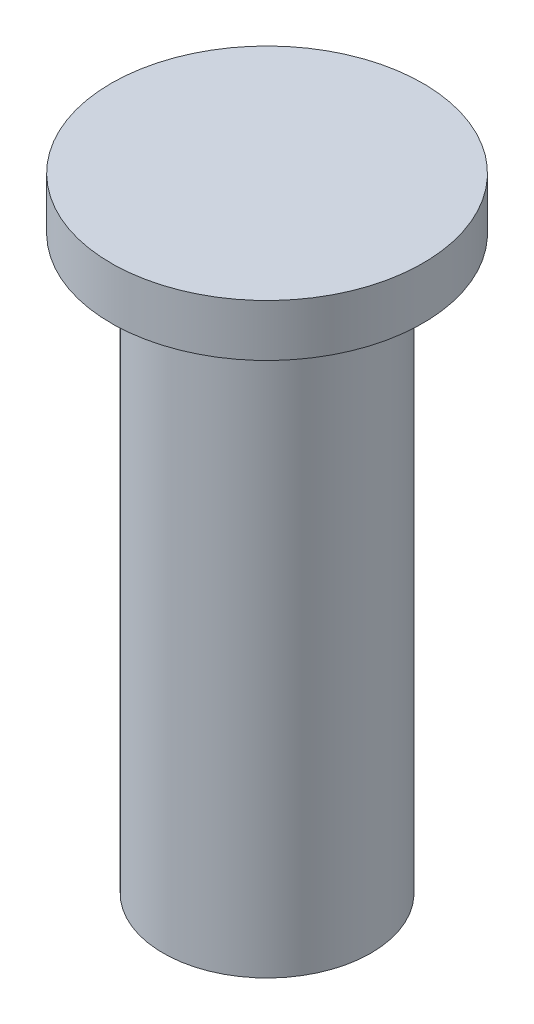
from build123d import *


with BuildPart() as part:
    # Croquis1 → Revolución1 (revolve)
    with BuildSketch(Plane.XY, mode=Mode.PRIVATE) as revoluci_n1_sk:
        Polygon((0, 0), (2, 0), (2, 11), (3, 11), (3, 12), (0, 12), align=None)
    revolve(revoluci_n1_sk.sketch.rotate(Axis((0, 12, 0), (0, -1, 0)), 180), axis=Axis((0, 12, 0), (0, -1, 0)))


solid = part.part
